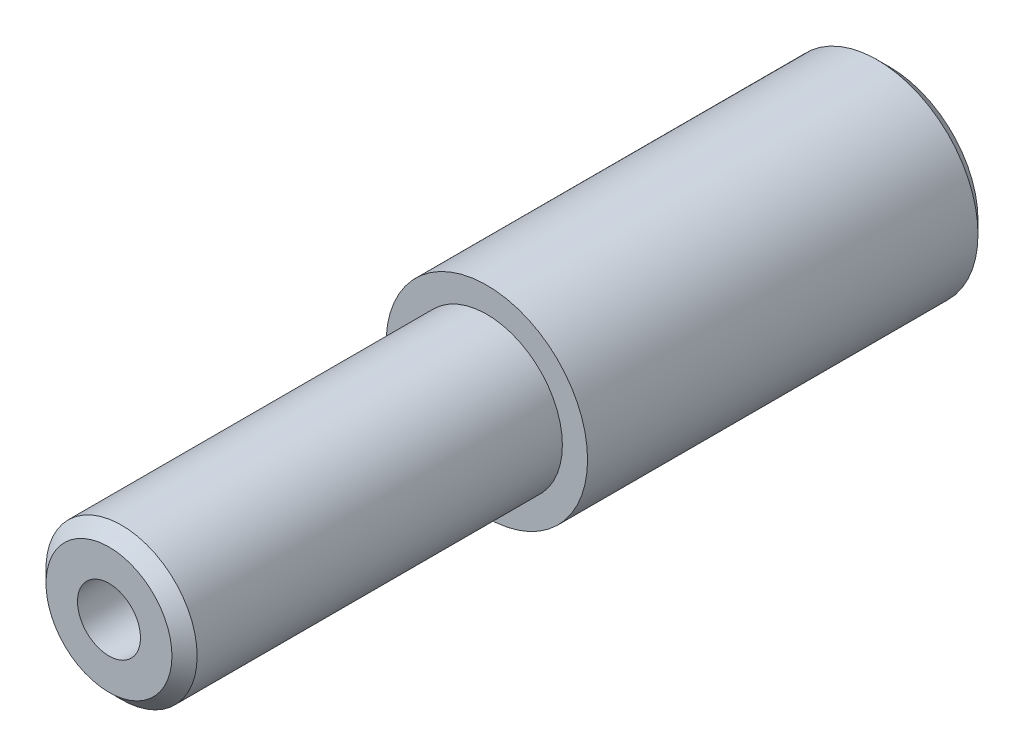
from build123d import *

# Parameters (mm, degrees)
SKETCH1_R           = 4
BOSS_EXTRUDE1_DEPTH = 16
SKETCH2_R           = 3
BOSS_EXTRUDE2_DEPTH = 15
SKETCH3_R           = 1.25
CUT_EXTRUDE1_DEPTH  = 40
CHAMFER1_SIZE       = 0.5


with BuildPart() as part:
    # Sketch1 → Boss-Extrude1 (new body)
    with BuildSketch(Plane.XY):
        with Locations((-161.229707574, -61.073300905)):
            Circle(SKETCH1_R)
    extrude(amount=BOSS_EXTRUDE1_DEPTH)

    # Sketch2 → Boss-Extrude2 (add)
    with BuildSketch(Plane.XY.offset(16)):
        with Locations((-161.229707574, -61.073300905)):
            Circle(SKETCH2_R)
    extrude(amount=BOSS_EXTRUDE2_DEPTH)

    # Sketch3 → Cut-Extrude1 (cut)
    with BuildSketch(Plane.XY.offset(31)):
        with Locations((-161.229707574, -61.073300905)):
            Circle(SKETCH3_R)
    extrude(amount=-CUT_EXTRUDE1_DEPTH, mode=Mode.SUBTRACT)

    # Chamfer1
    chamfer1_edges = [part.edges().sort_by_distance(p)[0] for p in [
        (-165.229707574, -61.073300905, 0),
        (-164.229707574, -61.073300905, 31),
    ]]
    chamfer(chamfer1_edges, length=CHAMFER1_SIZE)


solid = part.part
